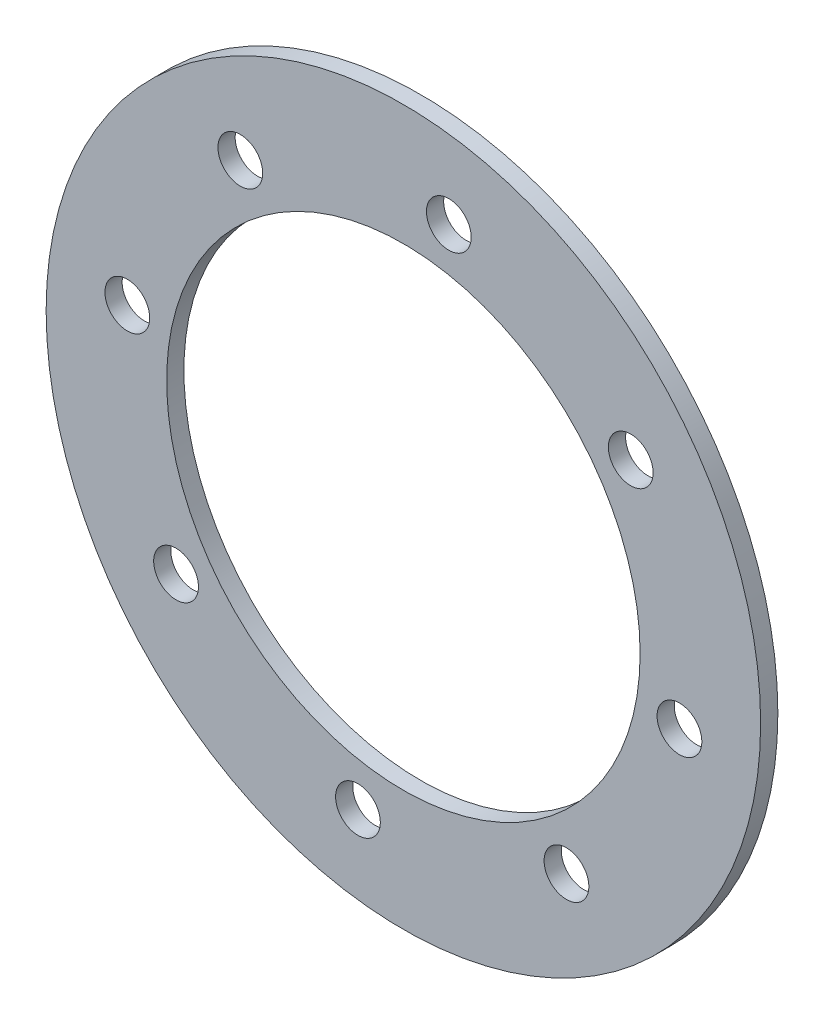
from build123d import *

# Parameters (mm, degrees)
SKETCH1_R           = 41.5
SKETCH1_R_2         = 27.5
SKETCH1_R_3         = 2.6
BOSS_EXTRUDE1_DEPTH = 2


with BuildPart() as part:
    # Sketch1 → Boss-Extrude1 (new body)
    with BuildSketch(Plane.XY):
        Circle(SKETCH1_R)
        Circle(SKETCH1_R_2, mode=Mode.SUBTRACT)
        with Locations((5.27873993, 32.068440947)):
            Circle(SKETCH1_R_3, mode=Mode.SUBTRACT)
        with Locations((26.408444856, 18.943179255)):
            Circle(SKETCH1_R_3, mode=Mode.SUBTRACT)
        with Locations((32.068440947, -5.27873993)):
            Circle(SKETCH1_R_3, mode=Mode.SUBTRACT)
        with Locations((18.943179255, -26.408444856)):
            Circle(SKETCH1_R_3, mode=Mode.SUBTRACT)
        with Locations((-5.27873993, -32.068440947)):
            Circle(SKETCH1_R_3, mode=Mode.SUBTRACT)
        with Locations((-26.408444856, -18.943179255)):
            Circle(SKETCH1_R_3, mode=Mode.SUBTRACT)
        with Locations((-32.068440947, 5.27873993)):
            Circle(SKETCH1_R_3, mode=Mode.SUBTRACT)
        with Locations((-18.943179255, 26.408444856)):
            Circle(SKETCH1_R_3, mode=Mode.SUBTRACT)
    extrude(amount=BOSS_EXTRUDE1_DEPTH)


solid = part.part
